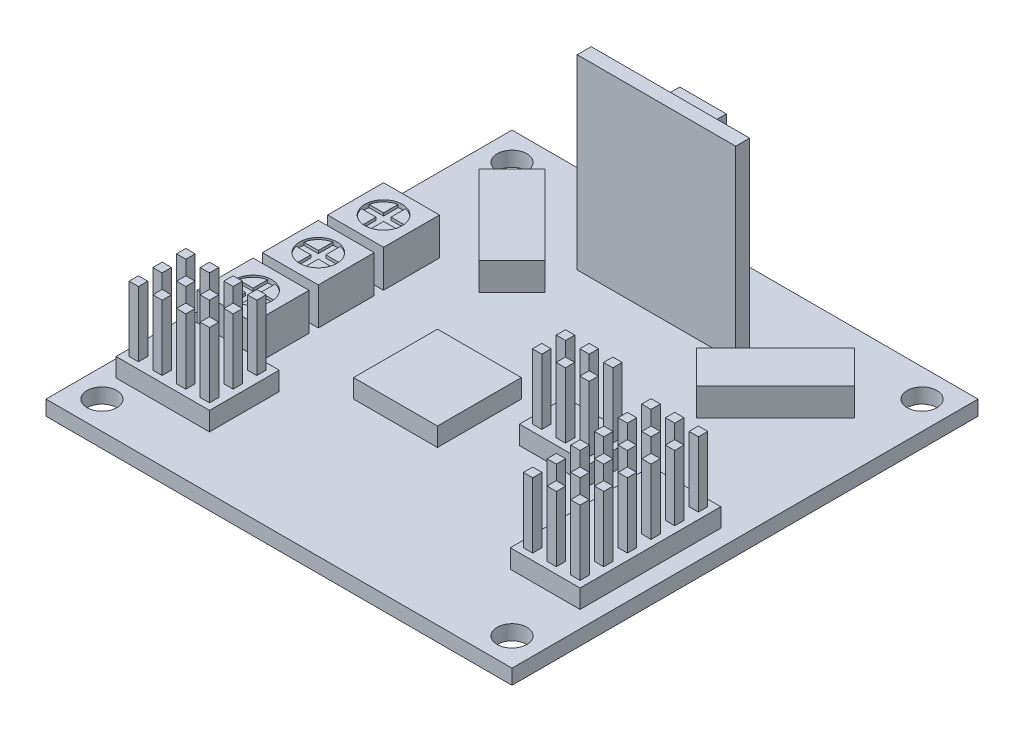
from build123d import *
from build123d.topology import SkipClean

# Parameters (mm, degrees)
SKETCH1_W            = 50
SKETCH1_H            = 50
SKETCH1_R            = 1.6
BOSS_EXTRUDE1_DEPTH  = 1.6
SKETCH2_W            = 6
SKETCH2_H            = 6
BOSS_EXTRUDE2_DEPTH  = 4
SKETCH3_R            = 2
CUT_EXTRUDE1_DEPTH   = 0.2
CUT_EXTRUDE2_DEPTH   = 0.5
SKETCH5_W            = 17
SKETCH5_H            = 1.5
BOSS_EXTRUDE3_DEPTH  = 20
SKETCH6_W            = 10.16
SKETCH6_H            = 3
BOSS_EXTRUDE4_DEPTH  = 2
BOSS_EXTRUDE5_DEPTH  = 3
SKETCH8_W            = 5
SKETCH8_H            = 12
BOSS_EXTRUDE6_DEPTH  = 3
SKETCH9_W            = 9
SKETCH9_H            = 9
BOSS_EXTRUDE7_DEPTH  = 2
SKETCH10_W           = 1
SKETCH10_H           = 1
BOSS_EXTRUDE8_DEPTH  = 9
SKETCH11_W           = 10.02
SKETCH11_H           = 7.48
SKETCH11_W_2         = 7.48
SKETCH11_H_2         = 4.94
SKETCH11_H_3         = 15.1
BOSS_EXTRUDE10_DEPTH = 2


with BuildPart() as part:
    # Sketch1 → Boss-Extrude1 (new body)
    with BuildSketch(Plane(origin=(0, 0, 0), x_dir=(1, 0, 0), z_dir=(0, 1, 0))):
        Rectangle(SKETCH1_W, SKETCH1_H)
        with Locations(Location((-22, 22, 0), (0, 0, 270))):
            Circle(SKETCH1_R, mode=Mode.SUBTRACT)
        with Locations(Location((22, 22, 0), (0, 0, 270))):
            Circle(SKETCH1_R, mode=Mode.SUBTRACT)
        with Locations(Location((22, -22, 0), (0, 0, 270))):
            Circle(SKETCH1_R, mode=Mode.SUBTRACT)
        with Locations(Location((-22, -22, 0), (0, 0, 270))):
            Circle(SKETCH1_R, mode=Mode.SUBTRACT)
    extrude(amount=BOSS_EXTRUDE1_DEPTH)

    # Sketch2 → Boss-Extrude2 (add)
    with BuildSketch(Plane(origin=(0, 1.6, 0), x_dir=(1, 0, 0), z_dir=(0, 1, 0))):
        with Locations((-20, -0.783142267)):
            Rectangle(SKETCH2_W, SKETCH2_H)
        with Locations((-20, 6.216857733)):
            Rectangle(SKETCH2_W, SKETCH2_H)
        with Locations((-20, -7.783142267)):
            Rectangle(SKETCH2_W, SKETCH2_H)
    extrude(amount=BOSS_EXTRUDE2_DEPTH)

    # Sketch3 → Cut-Extrude1 (cut)
    with BuildSketch(Plane(origin=(0, 5.6, 0), x_dir=(1, 0, 0), z_dir=(0, 1, 0))):
        with Locations(Location((-20, 6.216857733, 0), (0, 0, 270))):
            Circle(SKETCH3_R)
        with Locations(Location((-20, -0.783142267, 0), (0, 0, 270))):
            Circle(SKETCH3_R)
        with Locations(Location((-20, -7.783142267, 0), (0, 0, 270))):
            Circle(SKETCH3_R)
    extrude(amount=-CUT_EXTRUDE1_DEPTH, mode=Mode.SUBTRACT)

    # Sketch4 → Cut-Extrude2 (cut)
    with SkipClean():  # the faces are left unmerged after this step: merging them gives an invalid solid
        with BuildSketch(Plane(origin=(0, 5.6, 0), x_dir=(1, 0, 0), z_dir=(0, 1, 0))):
            with BuildLine():
                Line((-20.4, 6.616857733), (-21.959591794, 6.616857733))
                ThreePointArc((-21.959591794, 6.616857733), (-22, 6.216857733), (-21.959591794, 5.816857733))
                Line((-21.959591794, 5.816857733), (-20.4, 5.816857733))
                Line((-20.4, 5.816857733), (-20.4, 4.257265939))
                ThreePointArc((-20.4, 4.257265939), (-20, 4.216857733), (-19.6, 4.257265939))
                Line((-19.6, 4.257265939), (-19.6, 5.816857733))
                Line((-19.6, 5.816857733), (-18.040408206, 5.816857733))
                ThreePointArc((-18.040408206, 5.816857733), (-18.010127694, 6.015839809), (-18, 6.216857733))
                ThreePointArc((-18, 6.216857733), (-18.010127694, 6.417875657), (-18.040408206, 6.616857733))
                Line((-18.040408206, 6.616857733), (-19.6, 6.616857733))
                Line((-19.6, 6.616857733), (-19.6, 8.176449528))
                ThreePointArc((-19.6, 8.176449528), (-20, 8.216857733), (-20.4, 8.176449528))
                Line((-20.4, 8.176449528), (-20.4, 6.616857733))
            make_face()
            with BuildLine():
                Line((-20.4, -2.742734061), (-20.4, -1.183142267))
                Line((-20.4, -1.183142267), (-21.959591794, -1.183142267))
                ThreePointArc((-21.959591794, -1.183142267), (-22, -0.783142267), (-21.959591794, -0.383142267))
                Line((-21.959591794, -0.383142267), (-20.4, -0.383142267))
                Line((-20.4, -0.383142267), (-20.4, 1.176449528))
                ThreePointArc((-20.4, 1.176449528), (-20, 1.216857733), (-19.6, 1.176449528))
                Line((-19.6, 1.176449528), (-19.6, -0.383142267))
                Line((-19.6, -0.383142267), (-18.040408206, -0.383142267))
                ThreePointArc((-18.040408206, -0.383142267), (-18, -0.783142267), (-18.040408206, -1.183142267))
                Line((-18.040408206, -1.183142267), (-19.6, -1.183142267))
                Line((-19.6, -1.183142267), (-19.6, -2.742734061))
                ThreePointArc((-19.6, -2.742734061), (-20, -2.783142267), (-20.4, -2.742734061))
            make_face()
            with BuildLine():
                Line((-20.4, -9.742734061), (-20.4, -8.183142267))
                Line((-20.4, -8.183142267), (-21.959591794, -8.183142267))
                ThreePointArc((-21.959591794, -8.183142267), (-22, -7.783142267), (-21.959591794, -7.383142267))
                Line((-21.959591794, -7.383142267), (-20.4, -7.383142267))
                Line((-20.4, -7.383142267), (-20.4, -5.823550472))
                ThreePointArc((-20.4, -5.823550472), (-20, -5.783142267), (-19.6, -5.823550472))
                Line((-19.6, -5.823550472), (-19.6, -7.383142267))
                Line((-19.6, -7.383142267), (-18.040408206, -7.383142267))
                ThreePointArc((-18.040408206, -7.383142267), (-18, -7.783142267), (-18.040408206, -8.183142267))
                Line((-18.040408206, -8.183142267), (-19.6, -8.183142267))
                Line((-19.6, -8.183142267), (-19.6, -9.742734061))
                ThreePointArc((-19.6, -9.742734061), (-20, -9.783142267), (-20.4, -9.742734061))
            make_face()
        extrude(amount=-CUT_EXTRUDE2_DEPTH, mode=Mode.SUBTRACT)

    # Sketch5 → Boss-Extrude3 (add)
    with SkipClean():  # the faces are left unmerged after this step: merging them gives an invalid solid
        with BuildSketch(Plane(origin=(0, 1.6, 0), x_dir=(1, 0, 0), z_dir=(0, 1, 0))):
            with Locations((0, 16.25)):
                Rectangle(SKETCH5_W, SKETCH5_H)
        extrude(amount=BOSS_EXTRUDE3_DEPTH)

    # Sketch6 → Boss-Extrude4 (add)
    with SkipClean():  # the faces are left unmerged after this step: merging them gives an invalid solid
        with BuildSketch(Plane(origin=(0, 1.6, 0), x_dir=(1, 0, 0), z_dir=(0, 1, 0))):
            with Locations((0, 17)):
                Rectangle(SKETCH6_W, SKETCH6_H)
        extrude(amount=BOSS_EXTRUDE4_DEPTH)

    # Sketch7 → Boss-Extrude5 (add)
    with SkipClean():  # the faces are left unmerged after this step: merging them gives an invalid solid
        with BuildSketch(Plane(origin=(0, 1.6, 0), x_dir=(1, 0, 0), z_dir=(0, 1, 0))):
            Polygon((-20.152543264, 16.617009358), (-11.66726189, 8.131727984), (-8.131727984, 11.66726189), (-16.617009358, 20.152543264), align=None)
            Polygon((16.617009358, 20.152543264), (8.131727984, 11.66726189), (11.66726189, 8.131727984), (20.152543264, 16.617009358), align=None)
        extrude(amount=BOSS_EXTRUDE5_DEPTH)

    # Sketch8 → Boss-Extrude6 (add)
    with SkipClean():  # the faces are left unmerged after this step: merging them gives an invalid solid
        with BuildSketch(Plane(origin=(0, 0, -17), x_dir=(-1, 0, 0), z_dir=(0, 0, -1))):
            with Locations((-0.5, 13.6)):
                Rectangle(SKETCH8_W, SKETCH8_H)
        extrude(amount=BOSS_EXTRUDE6_DEPTH)

    # Sketch9 → Boss-Extrude7 (add)
    with SkipClean():  # the faces are left unmerged after this step: merging them gives an invalid solid
        with BuildSketch(Plane(origin=(0, 1.6, 0), x_dir=(1, 0, 0), z_dir=(0, 1, 0))):
            with Locations((-4, -4)):
                Rectangle(SKETCH9_W, SKETCH9_H)
        extrude(amount=BOSS_EXTRUDE7_DEPTH)

    # Sketch10 → Boss-Extrude8 (add)
    with SkipClean():  # the faces are left unmerged after this step: merging them gives an invalid solid
        with BuildSketch(Plane(origin=(0, 1.6, 0), x_dir=(1, 0, 0), z_dir=(0, 1, 0))):
            with Locations((-19.46, -13)):
                Rectangle(SKETCH10_W, SKETCH10_H)
            with Locations((-22, -13)):
                Rectangle(SKETCH10_W, SKETCH10_H)
            with Locations((-16.92, -13)):
                Rectangle(SKETCH10_W, SKETCH10_H)
            with Locations((-14.38, -13)):
                Rectangle(SKETCH10_W, SKETCH10_H)
            with Locations((-19.46, -15.54)):
                Rectangle(SKETCH10_W, SKETCH10_H)
            with Locations((-16.92, -15.54)):
                Rectangle(SKETCH10_W, SKETCH10_H)
            with Locations((-14.38, -15.54)):
                Rectangle(SKETCH10_W, SKETCH10_H)
            with Locations((-19.46, -18.08)):
                Rectangle(SKETCH10_W, SKETCH10_H)
            with Locations((-16.92, -18.08)):
                Rectangle(SKETCH10_W, SKETCH10_H)
            with Locations((-14.38, -18.08)):
                Rectangle(SKETCH10_W, SKETCH10_H)
            with Locations((-22, -15.54)):
                Rectangle(SKETCH10_W, SKETCH10_H)
            with Locations((-22, -18.08)):
                Rectangle(SKETCH10_W, SKETCH10_H)
            with Locations((22, -2)):
                Rectangle(SKETCH10_W, SKETCH10_H)
            with Locations((19.46, -2)):
                Rectangle(SKETCH10_W, SKETCH10_H)
            with Locations((16.92, -2)):
                Rectangle(SKETCH10_W, SKETCH10_H)
            with Locations((19.46, -4.54)):
                Rectangle(SKETCH10_W, SKETCH10_H)
            with Locations((16.92, -4.54)):
                Rectangle(SKETCH10_W, SKETCH10_H)
            with Locations((19.46, -7.08)):
                Rectangle(SKETCH10_W, SKETCH10_H)
            with Locations((16.92, -7.08)):
                Rectangle(SKETCH10_W, SKETCH10_H)
            with Locations((19.46, -9.62)):
                Rectangle(SKETCH10_W, SKETCH10_H)
            with Locations((16.92, -9.62)):
                Rectangle(SKETCH10_W, SKETCH10_H)
            with Locations((19.46, -12.16)):
                Rectangle(SKETCH10_W, SKETCH10_H)
            with Locations((16.92, -12.16)):
                Rectangle(SKETCH10_W, SKETCH10_H)
            with Locations((19.46, -14.7)):
                Rectangle(SKETCH10_W, SKETCH10_H)
            with Locations((16.92, -14.7)):
                Rectangle(SKETCH10_W, SKETCH10_H)
            with Locations((22, -4.54)):
                Rectangle(SKETCH10_W, SKETCH10_H)
            with Locations((22, -7.08)):
                Rectangle(SKETCH10_W, SKETCH10_H)
            with Locations((22, -9.62)):
                Rectangle(SKETCH10_W, SKETCH10_H)
            with Locations((22, -12.16)):
                Rectangle(SKETCH10_W, SKETCH10_H)
            with Locations((22, -14.7)):
                Rectangle(SKETCH10_W, SKETCH10_H)
            with Locations((8.46, -0.182312136)):
                Rectangle(SKETCH10_W, SKETCH10_H)
            with Locations((11, -0.182312136)):
                Rectangle(SKETCH10_W, SKETCH10_H)
            with Locations((5.92, -0.182312136)):
                Rectangle(SKETCH10_W, SKETCH10_H)
            with Locations((8.46, -2.722312136)):
                Rectangle(SKETCH10_W, SKETCH10_H)
            with Locations((5.92, -2.722312136)):
                Rectangle(SKETCH10_W, SKETCH10_H)
            with Locations((11, -2.722312136)):
                Rectangle(SKETCH10_W, SKETCH10_H)
        extrude(amount=BOSS_EXTRUDE8_DEPTH)

    # Sketch11 → Boss-Extrude10 (add)
    with SkipClean():  # the faces are left unmerged after this step: merging them gives an invalid solid
        with BuildSketch(Plane(origin=(0, 1.6, 0), x_dir=(1, 0, 0), z_dir=(0, 1, 0))):
            with Locations((-18.19, -15.54)):
                Rectangle(SKETCH11_W, SKETCH11_H)
            with Locations((8.46, -1.452312136)):
                Rectangle(SKETCH11_W_2, SKETCH11_H_2)
            with Locations((19.46, -8.35)):
                Rectangle(SKETCH11_W_2, SKETCH11_H_3)
        extrude(amount=BOSS_EXTRUDE10_DEPTH)


solid = part.part
